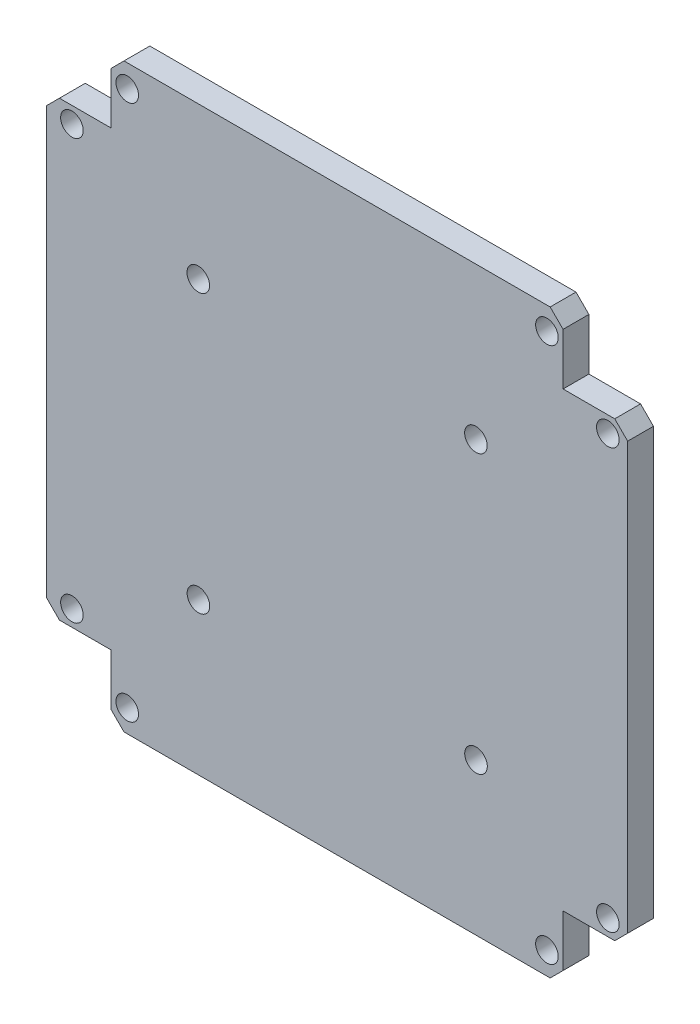
from build123d import *

# Parameters (mm, degrees)
SKETCH1_W           = 90
SKETCH1_H           = 70
BOSS_EXTRUDE1_DEPTH = 4
SKETCH2_R           = 1.75
CUT_EXTRUDE1_DEPTH  = 5
CHAMFER1_SIZE       = 2
CHAMFER2_SIZE       = 2
CHAMFER3_SIZE       = 2
CHAMFER4_SIZE       = 2
SKETCH5_W           = 70
SKETCH5_H           = 4
BOSS_EXTRUDE3_DEPTH = 10
SKETCH4_W           = 70
SKETCH4_H           = 4
BOSS_EXTRUDE4_DEPTH = 10
SKETCH6_R           = 1.75
CUT_EXTRUDE2_DEPTH  = 10
CHAMFER5_SIZE       = 2


with BuildPart() as part:
    # Sketch1 → Boss-Extrude1 (new body)
    with BuildSketch(Plane.XY):
        with Locations((44.768273235, 35.193370166)):
            Rectangle(SKETCH1_W, SKETCH1_H)
    extrude(amount=BOSS_EXTRUDE1_DEPTH)

    # Sketch2 → Cut-Extrude1 (cut)
    with BuildSketch(Plane.XY.offset(4)):
        with Locations((3.703568783, 2.693370166)):
            Circle(SKETCH2_R)
        with Locations((86.703568783, 2.694436567)):
            Circle(SKETCH2_R)
        with Locations((86.703273235, 67.693370166)):
            Circle(SKETCH2_R)
        with Locations((3.703273235, 67.693370166)):
            Circle(SKETCH2_R)
        with Locations((23.297725672, 13.693370166)):
            Circle(SKETCH2_R)
        with Locations((66.284051901, 13.693370166)):
            Circle(SKETCH2_R)
        with Locations((66.268273235, 56.693370166)):
            Circle(SKETCH2_R)
        with Locations((23.268273235, 56.693370166)):
            Circle(SKETCH2_R)
    extrude(amount=-CUT_EXTRUDE1_DEPTH, mode=Mode.SUBTRACT)

    # Chamfer1
    chamfer1_edges = [part.edges().sort_by_distance(p)[0] for p in [
        (89.768273235, 0.193370166, 2),
    ]]
    chamfer(chamfer1_edges, length=CHAMFER1_SIZE)

    # Chamfer2
    chamfer2_edges = [part.edges().sort_by_distance(p)[0] for p in [
        (-0.231726765, 0.193370166, 2),
    ]]
    chamfer(chamfer2_edges, length=CHAMFER2_SIZE)

    # Chamfer3
    chamfer3_edges = [part.edges().sort_by_distance(p)[0] for p in [
        (-0.231726765, 70.193370166, 2),
    ]]
    chamfer(chamfer3_edges, length=CHAMFER3_SIZE)

    # Chamfer4
    chamfer4_edges = [part.edges().sort_by_distance(p)[0] for p in [
        (89.768273235, 70.193370166, 2),
    ]]
    chamfer(chamfer4_edges, length=CHAMFER4_SIZE)

    # Sketch5 → Boss-Extrude3 (add)
    with BuildSketch(Plane(origin=(0, 70.193370166, 0), x_dir=(1, 0, 0), z_dir=(0, 1, 0))):
        with Locations((44.768273235, -2)):
            Rectangle(SKETCH5_W, SKETCH5_H)
    extrude(amount=BOSS_EXTRUDE3_DEPTH)

    # Sketch4 → Boss-Extrude4 (add)
    with BuildSketch(Plane(origin=(0, 0.193370166, 0), x_dir=(-1, 0, 0), z_dir=(0, -1, 0))):
        with Locations((-44.768273235, -2)):
            Rectangle(SKETCH4_W, SKETCH4_H)
    extrude(amount=BOSS_EXTRUDE4_DEPTH)

    # Sketch6 → Cut-Extrude2 (cut)
    with BuildSketch(Plane(origin=(0, 0, 0), x_dir=(-1, 0, 0), z_dir=(0, 0, -1))):
        with Locations((-12.268273235, 76.693370166)):
            Circle(SKETCH6_R)
        with Locations((-77.268273235, 76.693370166)):
            Circle(SKETCH6_R)
        with Locations((-77.268273235, -6.306629834)):
            Circle(SKETCH6_R)
        with Locations((-12.268273235, -6.306629834)):
            Circle(SKETCH6_R)
    extrude(amount=-CUT_EXTRUDE2_DEPTH, mode=Mode.SUBTRACT)

    # Chamfer5
    chamfer5_edges = [part.edges().sort_by_distance(p)[0] for p in [
        (9.768273235, 80.193370166, 2),
        (79.768273235, 80.193370166, 2),
        (9.768273235, -9.806629834, 2),
        (79.768273235, -9.806629834, 2),
    ]]
    chamfer(chamfer5_edges, length=CHAMFER5_SIZE)


solid = part.part
